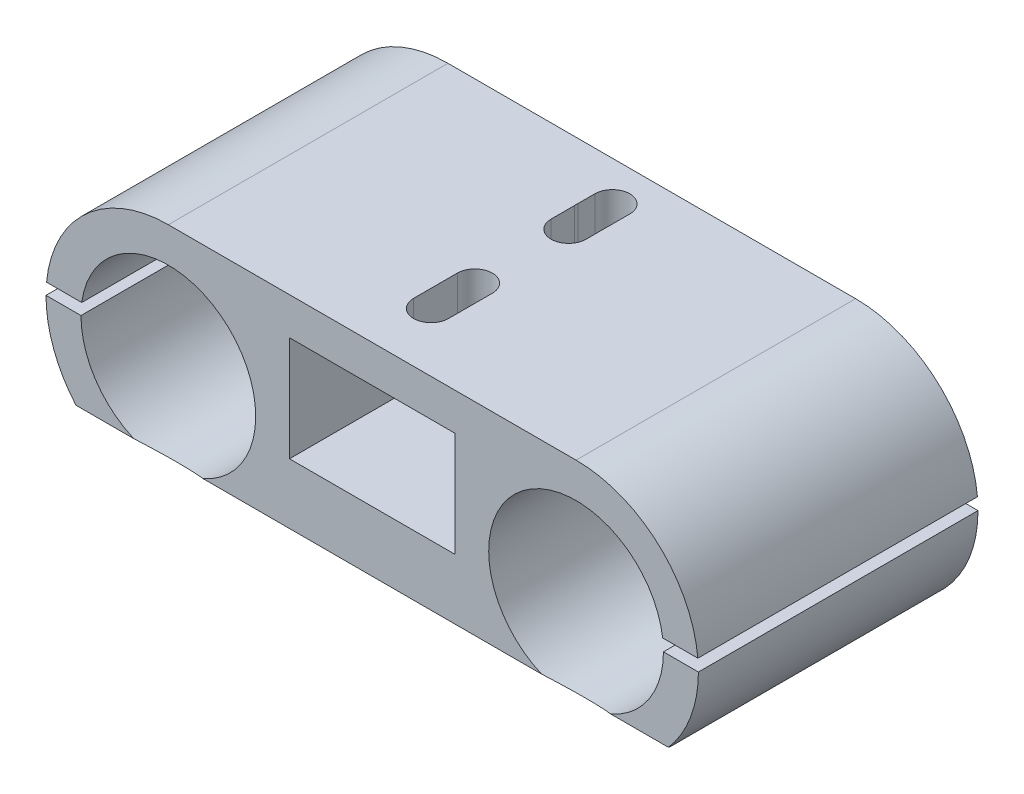
from build123d import *

# Parameters (mm, degrees)
SKETCH2_R               = 7.5
BOSS_EXTRUDE1_DEPTH     = 24
CUT_EXTRUDE2_DEPTH      = 40.913473307
CUT_EXTRUDE2_DEPTH_BACK = 40.913473307
SKETCH5_W               = 68.617197106
SKETCH5_H               = 1
SKETCH6_W               = 14.2
SKETCH6_H               = 9
CUT_EXTRUDE4_DEPTH      = 40.913473307
SKETCH7_R               = 1.5
CUT_EXTRUDE5_DEPTH      = 7
CUT_EXTRUDE6_DEPTH      = 40.913473307
CUT_EXTRUDE6_DEPTH_BACK = 40.913473307
SKETCH9_W               = 33.569510153
SKETCH9_H               = 1
CUT_EXTRUDE7_DEPTH      = 10
CUT_EXTRUDE8_DEPTH      = 42.952353927
CUT_EXTRUDE8_DEPTH_BACK = 6


with BuildPart() as part:
    # Sketch2 → Boss-Extrude1 (new body)
    with BuildSketch(Plane.XY):
        with BuildLine():
            Line((-17.5, -5.732866955), (-5, -5.732866955))
            Line((-5, -5.732866955), (17.5, -5.732866955))
            ThreePointArc((17.5, -5.732866955), (28, 4.767133045), (17.5, 15.267133045))
            Line((17.5, 15.267133045), (-17.5, 15.267133045))
            ThreePointArc((-17.5, 15.267133045), (-28, 4.767133045), (-17.5, -5.732866955))
        make_face()
        with Locations((-17.5, 4.767133045)):
            Circle(SKETCH2_R, mode=Mode.SUBTRACT)
        with Locations((17.5, 4.767133045)):
            Circle(SKETCH2_R, mode=Mode.SUBTRACT)
    extrude(amount=BOSS_EXTRUDE1_DEPTH)

    # Sketch5 → Cut-Extrude2 (cut, two sides: drawn at the far end of the back side and taken through both)
    with BuildSketch(Plane(origin=(0, 0, 0), x_dir=(-1, 0, 0), z_dir=(0, 0, -1)).offset(-CUT_EXTRUDE2_DEPTH_BACK)):
        with Locations((-5.849443293, -5.232866955)):
            Rectangle(SKETCH5_W, SKETCH5_H)
    extrude(amount=CUT_EXTRUDE2_DEPTH + CUT_EXTRUDE2_DEPTH_BACK, mode=Mode.SUBTRACT)

    # Sketch6 → Cut-Extrude4 (cut, through all)
    with BuildSketch(Plane(origin=(0, 0, 0), x_dir=(-1, 0, 0), z_dir=(0, 0, -1))):
        with Locations((0, 7.567133045)):
            Rectangle(SKETCH6_W, SKETCH6_H)
    extrude(amount=-CUT_EXTRUDE4_DEPTH, mode=Mode.SUBTRACT)

    # Sketch7 → Cut-Extrude5 (cut)
    with BuildSketch(Plane(origin=(0, 15.267133045, 0), x_dir=(1, 0, 0), z_dir=(0, 1, 0))):
        with Locations(Location((0, -5, 0), (0, 0, 270))):
            Circle(SKETCH7_R)
        with Locations(Location((0, -17, 0), (0, 0, 270))):
            Circle(SKETCH7_R)
    extrude(amount=-CUT_EXTRUDE5_DEPTH, mode=Mode.SUBTRACT)

    # Sketch8 → Cut-Extrude6 (cut, two sides: drawn at the far end of the back side and taken through both)
    with BuildSketch(Plane(origin=(0, 0, 0), x_dir=(0, 0, -1), z_dir=(1, 0, 0)).offset(-CUT_EXTRUDE6_DEPTH_BACK)):
        Polygon((-26.475275498, 0), (-18.93282628, -6.456635217), (-28.387151922, -5.921555858), align=None)
    extrude(amount=CUT_EXTRUDE6_DEPTH + CUT_EXTRUDE6_DEPTH_BACK, mode=Mode.SUBTRACT)

    # Sketch9 → Cut-Extrude7 (cut)
    with BuildSketch(Plane(origin=(30, 0, 0), x_dir=(0, 0, -1), z_dir=(1, 0, 0))):
        with Locations((-12.766874728, 5.267133045)):
            Rectangle(SKETCH9_W, SKETCH9_H)
    cut_extrude7 = extrude(amount=-CUT_EXTRUDE7_DEPTH, mode=Mode.SUBTRACT)

    # Mirror1: Cut-Extrude7 across plane
    add(cut_extrude7.mirror(Plane(origin=(0, 0, 0), x_dir=(0, 0, 1), z_dir=(1, 0, 0))), mode=Mode.SUBTRACT)

    # Sketch11 → Cut-Extrude8 (cut, two sides: drawn at the far end of the back side and taken through both)
    with BuildSketch(Plane(origin=(0, 15.267133045, 0), x_dir=(1, 0, 0), z_dir=(0, 1, 0)).offset(-CUT_EXTRUDE8_DEPTH_BACK)):
        with BuildLine():
            Line((-1.5, -18.944592398), (-1.5, -15.189153247))
            ThreePointArc((-1.5, -15.189153247), (0, -13.689153247), (1.5, -15.189153247))
            Line((1.5, -15.189153247), (1.5, -18.944592398))
            ThreePointArc((1.5, -18.944592398), (0, -20.444592398), (-1.5, -18.944592398))
        make_face()
        with BuildLine():
            Line((-1.492419394, -7.149757539), (-1.492419394, -3.394318388))
            ThreePointArc((-1.492419394, -3.394318388), (0.007580606, -1.894318388), (1.507580606, -3.394318388))
            Line((1.507580606, -3.394318388), (1.507580606, -7.149757539))
            ThreePointArc((1.507580606, -7.149757539), (0.007580606, -8.649757539), (-1.492419394, -7.149757539))
        make_face()
    extrude(amount=CUT_EXTRUDE8_DEPTH + CUT_EXTRUDE8_DEPTH_BACK, mode=Mode.SUBTRACT)


solid = part.part
